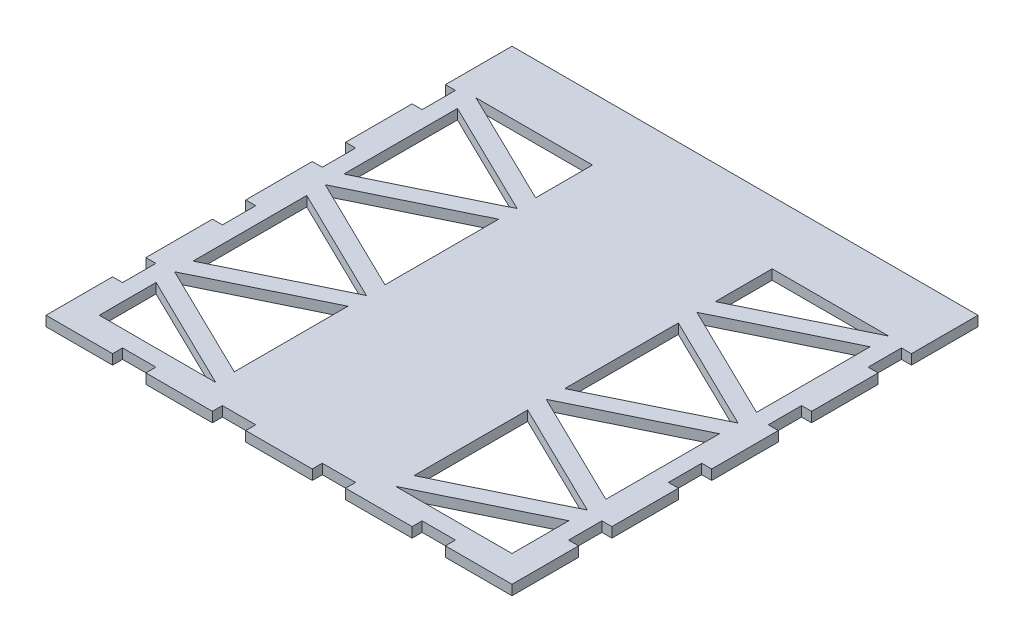
from build123d import *

# Parameters (mm, degrees)
SKETCH1_W           = 140
SKETCH1_H           = 140
BOSS_EXTRUDE1_DEPTH = 3
CUT_EXTRUDE1_DEPTH  = 10
SKETCH3_W           = 3
SKETCH3_H           = 10
CUT_EXTRUDE2_DEPTH  = 13
SKETCH4_W           = 10
SKETCH4_H           = 3
CUT_EXTRUDE3_DEPTH  = 13


with BuildPart() as part:
    # Sketch1 → Boss-Extrude1 (new body)
    with BuildSketch(Plane(origin=(0, 0, 0), x_dir=(1, 0, 0), z_dir=(0, 1, 0))):
        Rectangle(SKETCH1_W, SKETCH1_H)
    extrude(amount=BOSS_EXTRUDE1_DEPTH)

    # Sketch2 → Cut-Extrude1 (cut)
    with BuildSketch(Plane(origin=(0, 3, 0), x_dir=(1, 0, 0), z_dir=(0, 1, 0))):
        Polygon((62, -62), (27, -62), (62, -44.9293594), align=None)
        Polygon((27, -56.436990298), (62, -39.366349698), (27, -22.295709098), align=None)
        Polygon((27, -16.732699396), (62, 0.337941204), (62, -33.803339995), align=None)
        Polygon((62, 5.900950907), (27, -11.169689693), (27, 22.971591506), align=None)
        Polygon((27, 28.534601209), (62, 45.605241809), (62, 11.463960609), align=None)
        Polygon((27, 34.097610911), (62, 51.168251511), (27, 51.168251511), align=None)
        Polygon((-27, -62), (-62, -44.9293594), (-62, -62), align=None)
        Polygon((-62, -39.366349698), (-27, -22.295709098), (-27, -56.436990298), align=None)
        Polygon((-27, -16.732699396), (-62, -33.803339995), (-62, 0.337941204), align=None)
        Polygon((-27, 22.971591506), (-62, 5.900950907), (-27, -11.169689693), align=None)
        Polygon((-27, 28.534601209), (-62, 11.463960609), (-62, 45.605241809), align=None)
        Polygon((-62, 51.168251511), (-27, 51.168251511), (-27, 34.097610911), align=None)
    extrude(amount=-CUT_EXTRUDE1_DEPTH, mode=Mode.SUBTRACT)

    # Sketch3 → Cut-Extrude2 (cut)
    with BuildSketch(Plane(origin=(0, 3, 0), x_dir=(1, 0, 0), z_dir=(0, 1, 0))):
        with Locations((68.5, -45)):
            Rectangle(SKETCH3_W, SKETCH3_H)
        with Locations((68.5, -15)):
            Rectangle(SKETCH3_W, SKETCH3_H)
        with Locations((68.5, 15)):
            Rectangle(SKETCH3_W, SKETCH3_H)
        with Locations((68.5, 45)):
            Rectangle(SKETCH3_W, SKETCH3_H)
        with Locations((-68.5, -45)):
            Rectangle(SKETCH3_W, SKETCH3_H)
        with Locations((-68.5, -15)):
            Rectangle(SKETCH3_W, SKETCH3_H)
        with Locations((-68.5, 15)):
            Rectangle(SKETCH3_W, SKETCH3_H)
        with Locations((-68.5, 45)):
            Rectangle(SKETCH3_W, SKETCH3_H)
    extrude(amount=-CUT_EXTRUDE2_DEPTH, mode=Mode.SUBTRACT)

    # Sketch4 → Cut-Extrude3 (cut)
    with BuildSketch(Plane(origin=(0, 3, 0), x_dir=(1, 0, 0), z_dir=(0, 1, 0))):
        with Locations((-45, -68.5)):
            Rectangle(SKETCH4_W, SKETCH4_H)
        with Locations((-15, -68.5)):
            Rectangle(SKETCH4_W, SKETCH4_H)
        with Locations((15, -68.5)):
            Rectangle(SKETCH4_W, SKETCH4_H)
        with Locations((45, -68.5)):
            Rectangle(SKETCH4_W, SKETCH4_H)
    extrude(amount=-CUT_EXTRUDE3_DEPTH, mode=Mode.SUBTRACT)


solid = part.part
